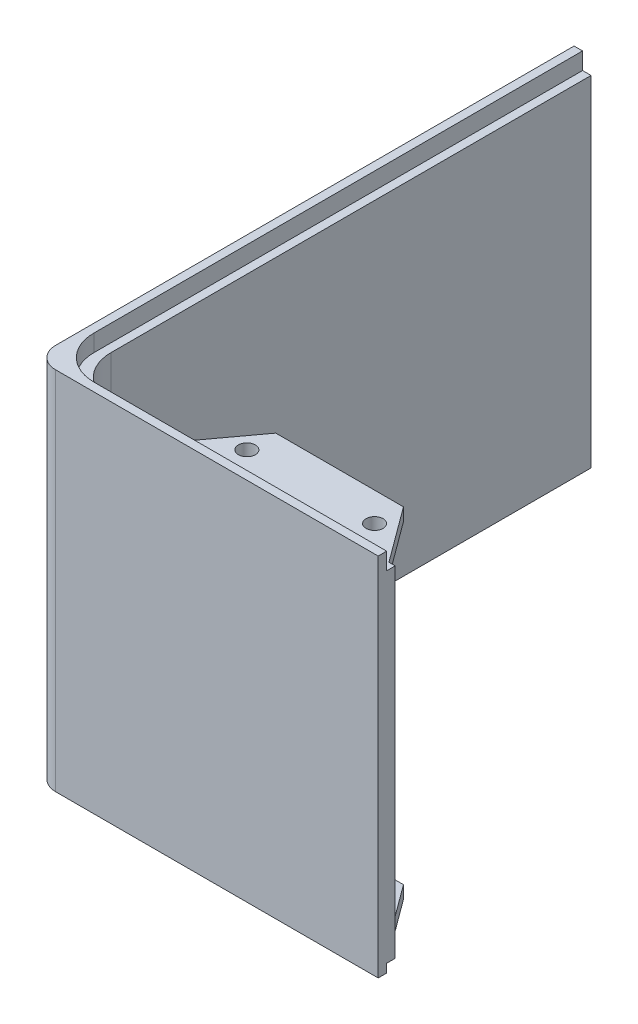
from build123d import *

# Parameters (mm, degrees)
SALIENTE_EXTRUIR1_DEPTH = 123
CROQUIS2_W              = 80.9
CROQUIS2_H              = 86
SALIENTE_EXTRUIR2_DEPTH = 4
CROQUIS3_W              = 2
CROQUIS3_H              = 4
CROQUIS3_H_2            = 2
CORTAR_EXTRUIR1_DEPTH   = 78.9
REDONDEO1_R             = 5
REDONDEO2_R             = 10
CROQUIS4_W              = 30.05
CROQUIS4_H              = 13
SALIENTE_EXTRUIR3_DEPTH = 3
CROQUIS5_R              = 2
CORTAR_EXTRUIR2_DEPTH   = 3


with BuildPart() as part:
    # Croquis1 → Saliente-Extruir1 (new body)
    with BuildSketch(Plane.XY):
        Polygon((1, 39), (1, 43), (-1, 43), (-1, -43), (1, -43), (1, -41), (3, -41), (3, 39), align=None)
    extrude(amount=SALIENTE_EXTRUIR1_DEPTH)

    # Croquis2 → Saliente-Extruir2 (add)
    with BuildSketch(Plane.XY.offset(123)):
        with Locations((39.45, 0)):
            Rectangle(CROQUIS2_W, CROQUIS2_H)
    extrude(amount=SALIENTE_EXTRUIR2_DEPTH)

    # Croquis3 → Cortar-Extruir1 (cut)
    with BuildSketch(Plane(origin=(79.9, 0, 0), x_dir=(0, 0, -1), z_dir=(1, 0, 0))):
        with Locations((-124, 41)):
            Rectangle(CROQUIS3_W, CROQUIS3_H)
        with Locations((-124, -42)):
            Rectangle(CROQUIS3_W, CROQUIS3_H_2)
    extrude(amount=-CORTAR_EXTRUIR1_DEPTH, mode=Mode.SUBTRACT)

    # Redondeo1
    redondeo1_edges = [part.edges().sort_by_distance(p)[0] for p in [
        (-1, 0, 127),
    ]]
    fillet(redondeo1_edges, radius=REDONDEO1_R)

    # Redondeo2
    redondeo2_edges = [part.edges().sort_by_distance(p)[0] for p in [
        (3, -1, 123),
        (1, 41, 125),
        (1, -42, 125),
    ]]
    fillet(redondeo2_edges, radius=REDONDEO2_R)

    # Croquis4 → Saliente-Extruir3 (add)
    with BuildSketch(Plane.XZ.offset(41)):
        with Locations((53.825, 116.5)):
            Rectangle(CROQUIS4_W, CROQUIS4_H)
        Polygon((29.222576035, 123), (38.8, 110), (38.8, 123), align=None)
        Polygon((68.85, 123), (68.85, 110), (78.426666667, 123), align=None)
    saliente_extruir3 = extrude(amount=-SALIENTE_EXTRUIR3_DEPTH)

    # Croquis5 → Cortar-Extruir2 (cut)
    with BuildSketch(Plane(origin=(0, -38, 0), x_dir=(1, 0, 0), z_dir=(0, 1, 0))):
        with Locations(Location((38.8, -116.8, 0), (0, 0, 270))):
            Circle(CROQUIS5_R)
        with Locations(Location((68.85, -116.8, 0), (0, 0, 270))):
            Circle(CROQUIS5_R)
    cortar_extruir2 = extrude(amount=-CORTAR_EXTRUIR2_DEPTH, mode=Mode.SUBTRACT)

    # Simetría1: Saliente-Extruir3, Cortar-Extruir2 across plane
    add(saliente_extruir3.mirror(Plane(origin=(0, -1, 0), x_dir=(0, 0, 1), z_dir=(0, -1, 0))))
    add(cortar_extruir2.mirror(Plane(origin=(0, -1, 0), x_dir=(0, 0, 1), z_dir=(0, -1, 0))), mode=Mode.SUBTRACT)


solid = part.part
